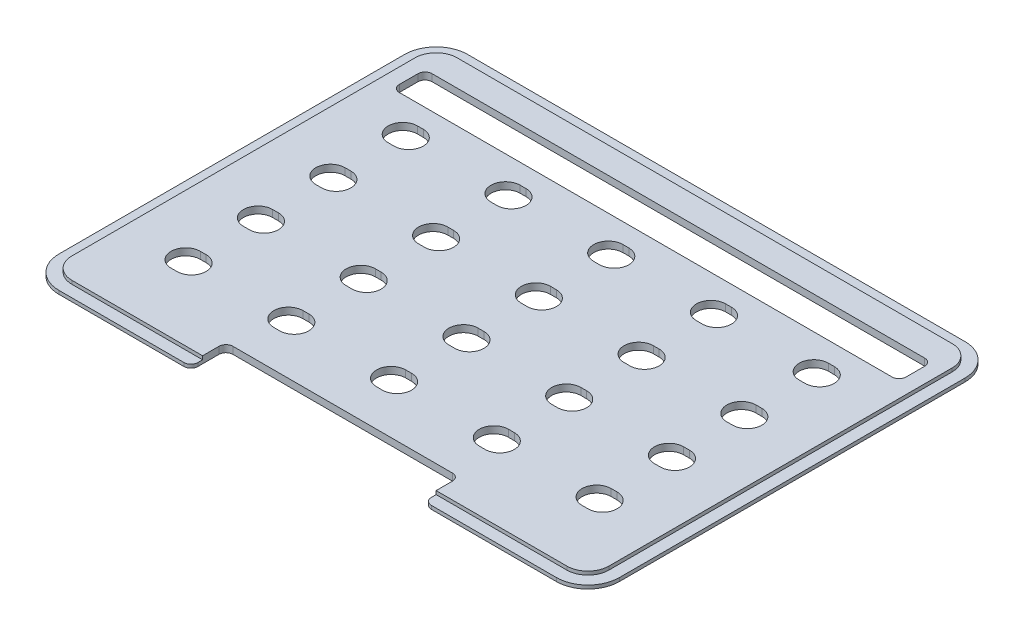
from build123d import *

# Parameters (mm, degrees)
SKETCH1_W                = 240
SKETCH1_H                = 175
OUTER_PROFILE_DEPTH      = 1.5
SKETCH2_W                = 230
SKETCH2_H                = 165
INNER_PROFILE_DEPTH      = 1.5
FILLET1_R                = 9
FILLET2_R                = 13.5
CUTOUT_DEPTH             = 149.543764595
CUTOUTS_COUNT            = 3
CUTOUTS_PITCH            = 44
CUTOUTS_COUNT_DIR2       = 4
CUTOUTS_PITCH_DIR2       = 31
MIRROR1_COPY_1_DEPTH     = 149.543764595
MIRROR1_COPY_2_DEPTH     = 149.543764595
MIRROR1_COPY_3_DEPTH     = 149.543764595
MIRROR1_COPY_4_DEPTH     = 149.543764595
MIRROR1_COPY_5_DEPTH     = 149.543764595
MIRROR1_COPY_6_DEPTH     = 149.543764595
MIRROR1_COPY_7_DEPTH     = 149.543764595
MIRROR1_COPY_8_DEPTH     = 149.543764595
MIRROR1_COPY_9_DEPTH     = 149.543764595
MIRROR1_COPY_10_DEPTH    = 149.543764595
MIRROR1_COPY_11_DEPTH    = 149.543764595
MIRROR1_COPY_12_DEPTH    = 149.543764595
SKETCH4_W                = 217
SKETCH4_H                = 14
MESSAGE_WINDOW_DEPTH     = 149.543764595
MESSAGE_WINDOW_CORNERS_R = 3
SKETCH6_W                = 100
SKETCH6_H                = 15
BASE_CUTBACK_DEPTH       = 149.543764595
FILLET5_R                = 3


with BuildPart() as part:
    # Sketch1 → Outer Profile (new body)
    with BuildSketch(Plane(origin=(0, 0, 0), x_dir=(1, 0, 0), z_dir=(0, 1, 0))):
        Rectangle(SKETCH1_W, SKETCH1_H)
    extrude(amount=OUTER_PROFILE_DEPTH)

    # Sketch2 → Inner Profile (add)
    with BuildSketch(Plane(origin=(0, 1.5, 0), x_dir=(1, 0, 0), z_dir=(0, 1, 0))):
        Rectangle(SKETCH2_W, SKETCH2_H)
    extrude(amount=INNER_PROFILE_DEPTH)

    # Fillet1
    fillet1_edges = [part.edges().sort_by_distance(p)[0] for p in [
        (115, 2.25, 82.5),
        (115, 2.25, -82.5),
        (-115, 2.25, -82.5),
        (-115, 2.25, 82.5),
    ]]
    fillet(fillet1_edges, radius=FILLET1_R)

    # Fillet2
    fillet2_edges = [part.edges().sort_by_distance(p)[0] for p in [
        (120, 0.75, 87.5),
        (-120, 0.75, 87.5),
        (-120, 0.75, -87.5),
        (120, 0.75, -87.5),
    ]]
    fillet(fillet2_edges, radius=FILLET2_R)

    # Sketch3 → Cutout (cut, through all)
    with BuildSketch(Plane(origin=(0, 3, 0), x_dir=(1, 0, 0), z_dir=(0, 1, 0))):
        with BuildLine():
            Line((-1.25, -44.25), (1.25, -44.25))
            ThreePointArc((1.25, -44.25), (7.5, -50.5), (1.25, -56.75))
            Line((1.25, -56.75), (-1.25, -56.75))
            ThreePointArc((-1.25, -56.75), (-7.5, -50.5), (-1.25, -44.25))
        make_face()
    cutout = extrude(amount=-CUTOUT_DEPTH, mode=Mode.SUBTRACT)

    # Cutouts: Cutout 3 × 4
    with Locations(*[(-i * CUTOUTS_PITCH, 0, -j * CUTOUTS_PITCH_DIR2) for i in range(CUTOUTS_COUNT) for j in range(CUTOUTS_COUNT_DIR2) if (i, j) != (0, 0)]):
        add(cutout, mode=Mode.SUBTRACT)

    # Mirror1 copy 1 sketch → Mirror1 copy 1 (cut, through all)
    with BuildSketch(Plane(origin=(0, 3, -31), x_dir=(-1, 0, 0), z_dir=(0, 1, 0))):
        with BuildLine():
            Line((-1.25, 44.25), (1.25, 44.25))
            ThreePointArc((1.25, 44.25), (7.5, 50.5), (1.25, 56.75))
            Line((1.25, 56.75), (-1.25, 56.75))
            ThreePointArc((-1.25, 56.75), (-7.5, 50.5), (-1.25, 44.25))
        make_face()
    extrude(amount=-MIRROR1_COPY_1_DEPTH, mode=Mode.SUBTRACT)

    # Mirror1 copy 2 sketch → Mirror1 copy 2 (cut, through all)
    with BuildSketch(Plane(origin=(0, 3, -62), x_dir=(-1, 0, 0), z_dir=(0, 1, 0))):
        with BuildLine():
            Line((-1.25, 44.25), (1.25, 44.25))
            ThreePointArc((1.25, 44.25), (7.5, 50.5), (1.25, 56.75))
            Line((1.25, 56.75), (-1.25, 56.75))
            ThreePointArc((-1.25, 56.75), (-7.5, 50.5), (-1.25, 44.25))
        make_face()
    extrude(amount=-MIRROR1_COPY_2_DEPTH, mode=Mode.SUBTRACT)

    # Mirror1 copy 3 sketch → Mirror1 copy 3 (cut, through all)
    with BuildSketch(Plane(origin=(0, 3, -93), x_dir=(-1, 0, 0), z_dir=(0, 1, 0))):
        with BuildLine():
            Line((-1.25, 44.25), (1.25, 44.25))
            ThreePointArc((1.25, 44.25), (7.5, 50.5), (1.25, 56.75))
            Line((1.25, 56.75), (-1.25, 56.75))
            ThreePointArc((-1.25, 56.75), (-7.5, 50.5), (-1.25, 44.25))
        make_face()
    extrude(amount=-MIRROR1_COPY_3_DEPTH, mode=Mode.SUBTRACT)

    # Mirror1 copy 4 sketch → Mirror1 copy 4 (cut, through all)
    with BuildSketch(Plane(origin=(44, 3, 0), x_dir=(-1, 0, 0), z_dir=(0, 1, 0))):
        with BuildLine():
            Line((-1.25, 44.25), (1.25, 44.25))
            ThreePointArc((1.25, 44.25), (7.5, 50.5), (1.25, 56.75))
            Line((1.25, 56.75), (-1.25, 56.75))
            ThreePointArc((-1.25, 56.75), (-7.5, 50.5), (-1.25, 44.25))
        make_face()
    extrude(amount=-MIRROR1_COPY_4_DEPTH, mode=Mode.SUBTRACT)

    # Mirror1 copy 5 sketch → Mirror1 copy 5 (cut, through all)
    with BuildSketch(Plane(origin=(44, 3, -31), x_dir=(-1, 0, 0), z_dir=(0, 1, 0))):
        with BuildLine():
            Line((-1.25, 44.25), (1.25, 44.25))
            ThreePointArc((1.25, 44.25), (7.5, 50.5), (1.25, 56.75))
            Line((1.25, 56.75), (-1.25, 56.75))
            ThreePointArc((-1.25, 56.75), (-7.5, 50.5), (-1.25, 44.25))
        make_face()
    extrude(amount=-MIRROR1_COPY_5_DEPTH, mode=Mode.SUBTRACT)

    # Mirror1 copy 6 sketch → Mirror1 copy 6 (cut, through all)
    with BuildSketch(Plane(origin=(44, 3, -62), x_dir=(-1, 0, 0), z_dir=(0, 1, 0))):
        with BuildLine():
            Line((-1.25, 44.25), (1.25, 44.25))
            ThreePointArc((1.25, 44.25), (7.5, 50.5), (1.25, 56.75))
            Line((1.25, 56.75), (-1.25, 56.75))
            ThreePointArc((-1.25, 56.75), (-7.5, 50.5), (-1.25, 44.25))
        make_face()
    extrude(amount=-MIRROR1_COPY_6_DEPTH, mode=Mode.SUBTRACT)

    # Mirror1 copy 7 sketch → Mirror1 copy 7 (cut, through all)
    with BuildSketch(Plane(origin=(44, 3, -93), x_dir=(-1, 0, 0), z_dir=(0, 1, 0))):
        with BuildLine():
            Line((-1.25, 44.25), (1.25, 44.25))
            ThreePointArc((1.25, 44.25), (7.5, 50.5), (1.25, 56.75))
            Line((1.25, 56.75), (-1.25, 56.75))
            ThreePointArc((-1.25, 56.75), (-7.5, 50.5), (-1.25, 44.25))
        make_face()
    extrude(amount=-MIRROR1_COPY_7_DEPTH, mode=Mode.SUBTRACT)

    # Mirror1 copy 8 sketch → Mirror1 copy 8 (cut, through all)
    with BuildSketch(Plane(origin=(88, 3, 0), x_dir=(-1, 0, 0), z_dir=(0, 1, 0))):
        with BuildLine():
            Line((-1.25, 44.25), (1.25, 44.25))
            ThreePointArc((1.25, 44.25), (7.5, 50.5), (1.25, 56.75))
            Line((1.25, 56.75), (-1.25, 56.75))
            ThreePointArc((-1.25, 56.75), (-7.5, 50.5), (-1.25, 44.25))
        make_face()
    extrude(amount=-MIRROR1_COPY_8_DEPTH, mode=Mode.SUBTRACT)

    # Mirror1 copy 9 sketch → Mirror1 copy 9 (cut, through all)
    with BuildSketch(Plane(origin=(88, 3, -31), x_dir=(-1, 0, 0), z_dir=(0, 1, 0))):
        with BuildLine():
            Line((-1.25, 44.25), (1.25, 44.25))
            ThreePointArc((1.25, 44.25), (7.5, 50.5), (1.25, 56.75))
            Line((1.25, 56.75), (-1.25, 56.75))
            ThreePointArc((-1.25, 56.75), (-7.5, 50.5), (-1.25, 44.25))
        make_face()
    extrude(amount=-MIRROR1_COPY_9_DEPTH, mode=Mode.SUBTRACT)

    # Mirror1 copy 10 sketch → Mirror1 copy 10 (cut, through all)
    with BuildSketch(Plane(origin=(88, 3, -62), x_dir=(-1, 0, 0), z_dir=(0, 1, 0))):
        with BuildLine():
            Line((-1.25, 44.25), (1.25, 44.25))
            ThreePointArc((1.25, 44.25), (7.5, 50.5), (1.25, 56.75))
            Line((1.25, 56.75), (-1.25, 56.75))
            ThreePointArc((-1.25, 56.75), (-7.5, 50.5), (-1.25, 44.25))
        make_face()
    extrude(amount=-MIRROR1_COPY_10_DEPTH, mode=Mode.SUBTRACT)

    # Mirror1 copy 11 sketch → Mirror1 copy 11 (cut, through all)
    with BuildSketch(Plane(origin=(88, 3, -93), x_dir=(-1, 0, 0), z_dir=(0, 1, 0))):
        with BuildLine():
            Line((-1.25, 44.25), (1.25, 44.25))
            ThreePointArc((1.25, 44.25), (7.5, 50.5), (1.25, 56.75))
            Line((1.25, 56.75), (-1.25, 56.75))
            ThreePointArc((-1.25, 56.75), (-7.5, 50.5), (-1.25, 44.25))
        make_face()
    extrude(amount=-MIRROR1_COPY_11_DEPTH, mode=Mode.SUBTRACT)

    # Mirror1 copy 12 sketch → Mirror1 copy 12 (cut, through all)
    with BuildSketch(Plane(origin=(0, 3, 0), x_dir=(-1, 0, 0), z_dir=(0, 1, 0))):
        with BuildLine():
            Line((-1.25, 44.25), (1.25, 44.25))
            ThreePointArc((1.25, 44.25), (7.5, 50.5), (1.25, 56.75))
            Line((1.25, 56.75), (-1.25, 56.75))
            ThreePointArc((-1.25, 56.75), (-7.5, 50.5), (-1.25, 44.25))
        make_face()
    extrude(amount=-MIRROR1_COPY_12_DEPTH, mode=Mode.SUBTRACT)

    # Sketch4 → Message Window (cut, through all)
    with BuildSketch(Plane(origin=(0, 3, 0), x_dir=(1, 0, 0), z_dir=(0, 1, 0))):
        with Locations((0, 64.25)):
            Rectangle(SKETCH4_W, SKETCH4_H)
    extrude(amount=-MESSAGE_WINDOW_DEPTH, mode=Mode.SUBTRACT)

    # Message Window Corners
    message_window_corners_edges = [part.edges().sort_by_distance(p)[0] for p in [
        (-108.5, 1.5, -57.25),
        (-108.5, 1.5, -71.25),
        (108.5, 1.5, -71.25),
        (108.5, 1.5, -57.25),
    ]]
    fillet(message_window_corners_edges, radius=MESSAGE_WINDOW_CORNERS_R)

    # Sketch6 → Base Cutback (cut, through all)
    with BuildSketch(Plane(origin=(0, 3, 0), x_dir=(1, 0, 0), z_dir=(0, 1, 0))):
        with Locations((0, -80)):
            Rectangle(SKETCH6_W, SKETCH6_H)
    extrude(amount=-BASE_CUTBACK_DEPTH, mode=Mode.SUBTRACT)

    # Fillet5
    fillet5_edges = [part.edges().sort_by_distance(p)[0] for p in [
        (50, 0.75, 87.5),
        (50, 1.5, 72.5),
        (-50, 0.75, 87.5),
        (-50, 1.5, 72.5),
    ]]
    fillet(fillet5_edges, radius=FILLET5_R)


solid = part.part
